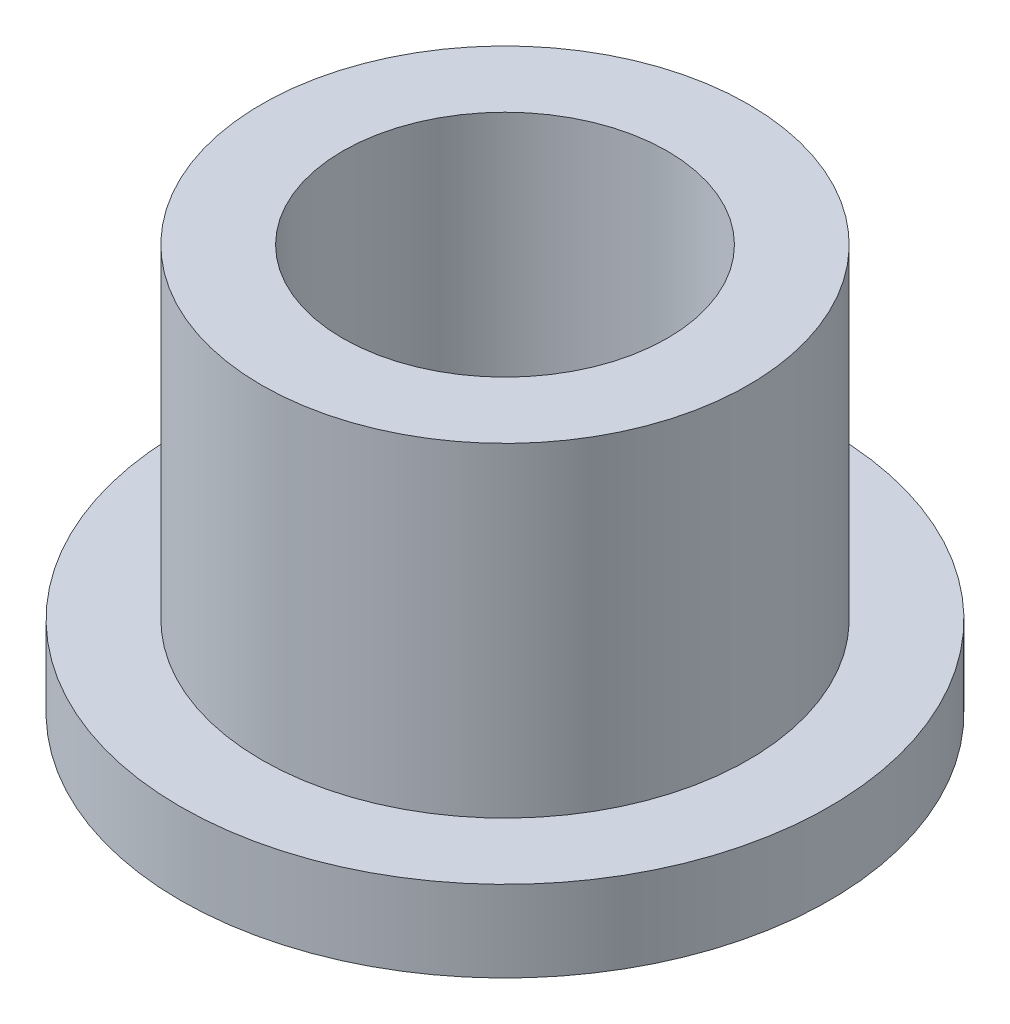
from build123d import *

# Parameters (mm, degrees)
SKETCH2_R           = 4.7625
SKETCH2_R_2         = 3.175
BOSS_EXTRUDE1_DEPTH = 7.9375
SKETCH3_R           = 6.35
SKETCH3_R_2         = 4.7625
BOSS_EXTRUDE2_DEPTH = 1.5875


with BuildPart() as part:
    # Sketch2 → Boss-Extrude1 (new body)
    with BuildSketch(Plane(origin=(0, 0, 0), x_dir=(1, 0, 0), z_dir=(0, 1, 0))):
        with Locations(Location((0, 0, 0), (0, 0, 270))):
            Circle(SKETCH2_R)
        with Locations(Location((0, 0, 0), (0, 0, 270))):
            Circle(SKETCH2_R_2, mode=Mode.SUBTRACT)
    extrude(amount=BOSS_EXTRUDE1_DEPTH)

    # Sketch3 → Boss-Extrude2 (add)
    with BuildSketch(Plane(origin=(0, 0, 0), x_dir=(1, 0, 0), z_dir=(0, 1, 0))):
        with Locations(Location((0, 0, 0), (0, 0, 270))):
            Circle(SKETCH3_R)
        with Locations(Location((0, 0, 0), (0, 0, 270))):
            Circle(SKETCH3_R_2, mode=Mode.SUBTRACT)
    extrude(amount=BOSS_EXTRUDE2_DEPTH)


solid = part.part
